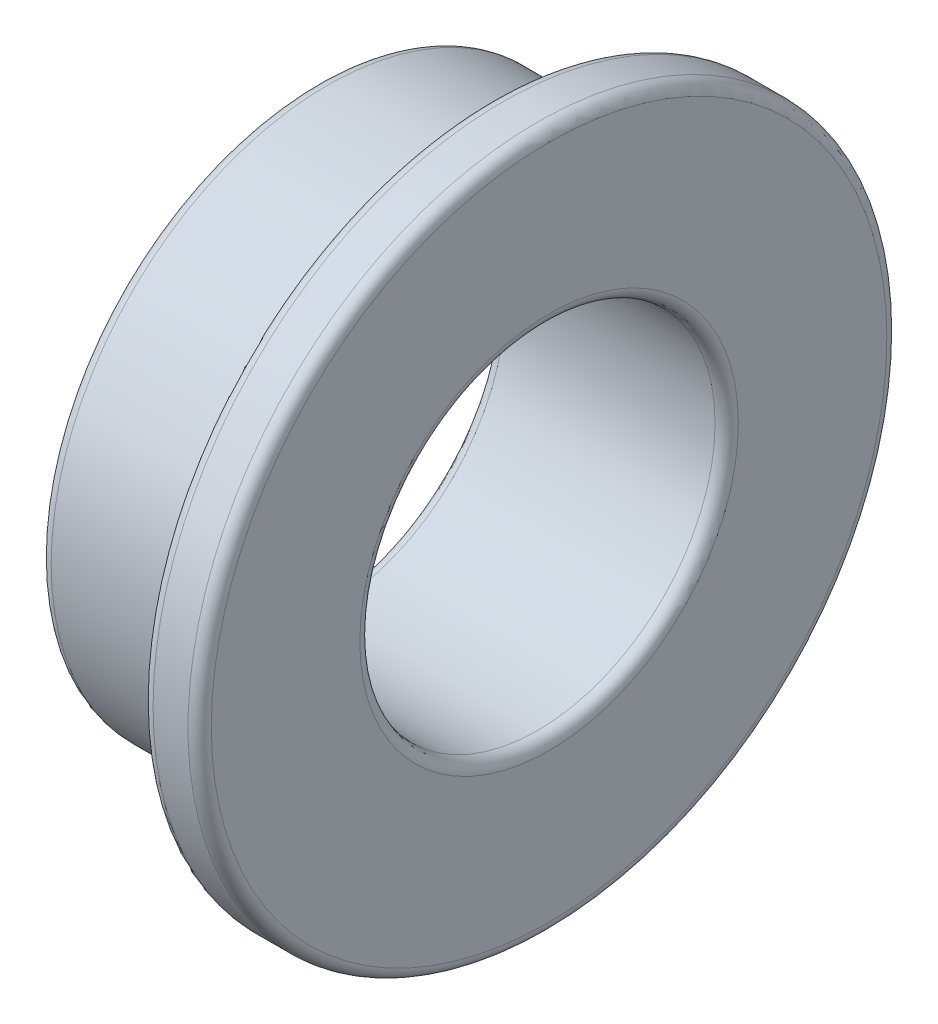
from build123d import *

# Parameters (mm, degrees)
CUT_EXTRUDE1_REACH = 11.381
SKETCH2_R          = 3.05
FILLET1_R          = 0.2


with BuildPart() as part:
    # Sketch1 → Revolve1 (revolve)
    with BuildSketch(Plane.XY, mode=Mode.PRIVATE) as revolve1_sk:
        Polygon((-4, 0), (-4, 4.75), (-1, 4.75), (-1, 6), (0, 6), (0, 0), align=None)
    revolve(revolve1_sk.sketch.rotate(Axis((0, 0, 0), (-1, 0, 0)), 90), axis=Axis((0, 0, 0), (-1, 0, 0)))

    # Sketch2 → Cut-Extrude1 (cut, up to next)
    with BuildSketch(Plane(origin=(0, 0, 0), x_dir=(0, 0, -1), z_dir=(1, 0, 0)), mode=Mode.PRIVATE) as cut_extrude1_sk1:
        Circle(SKETCH2_R)
    cut_extrude1_tool1 = extrude(cut_extrude1_sk1.sketch, amount=-CUT_EXTRUDE1_REACH, mode=Mode.PRIVATE) & part.part
    add(cut_extrude1_tool1.solids().sort_by_distance((0, 0, 0))[0], mode=Mode.SUBTRACT)

    # Fillet1
    fillet1_edges = [part.edges().sort_by_distance(p)[0] for p in [
        (-4, 0, 3.05),
        (0, 0, 3.05),
        (0, 0, 6),
        (-1, 0, 6),
        (-1, 0, 4.75),
        (-4, 0, 4.75),
    ]]
    fillet(fillet1_edges, radius=FILLET1_R)


solid = part.part
